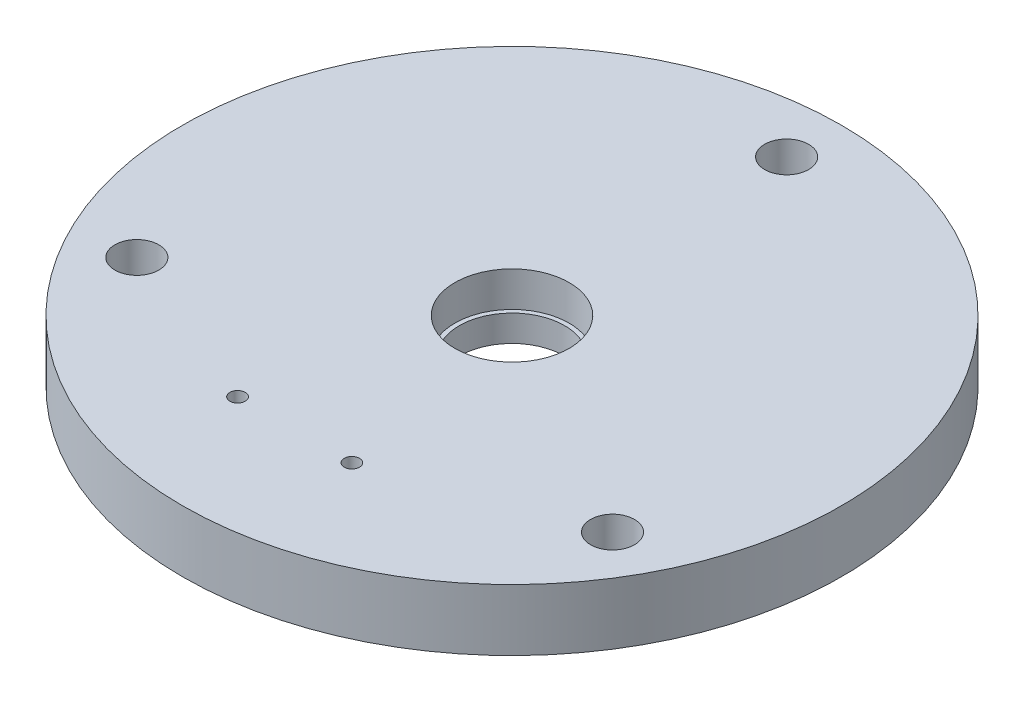
from build123d import *

# Parameters (mm, degrees)
SKETCH1_R           = 75
BOSS_EXTRUDE1_DEPTH = 14
SKETCH2_R           = 13
CUT_EXTRUDE1_DEPTH  = 8
SKETCH3_R           = 12
CUT_EXTRUDE2_DEPTH  = 8
SKETCH4_R           = 5
CUT_EXTRUDE4_DEPTH  = 107.98598039
SKETCH5_R           = 1.75
CUT_EXTRUDE5_DEPTH  = 107.98598039


with BuildPart() as part:
    # Sketch1 → Boss-Extrude1 (new body)
    with BuildSketch(Plane(origin=(0, 0, 0), x_dir=(1, 0, 0), z_dir=(0, 1, 0))):
        with Locations(Location((0, 0, 0), (0, 0, 270))):
            Circle(SKETCH1_R)
    extrude(amount=BOSS_EXTRUDE1_DEPTH)

    # Sketch2 → Cut-Extrude1 (cut)
    with BuildSketch(Plane(origin=(0, 14, 0), x_dir=(1, 0, 0), z_dir=(0, 1, 0))):
        with Locations(Location((0, 0, 0), (0, 0, 270))):
            Circle(SKETCH2_R)
    extrude(amount=-CUT_EXTRUDE1_DEPTH, mode=Mode.SUBTRACT)

    # Sketch3 → Cut-Extrude2 (cut)
    with BuildSketch(Plane(origin=(0, 6, 0), x_dir=(1, 0, 0), z_dir=(0, 1, 0))):
        with Locations(Location((0, 0, 0), (0, 0, 270))):
            Circle(SKETCH3_R)
    extrude(amount=-CUT_EXTRUDE2_DEPTH, mode=Mode.SUBTRACT)

    # Sketch4 → Cut-Extrude4 (cut, through all)
    with BuildSketch(Plane(origin=(0, 14, 0), x_dir=(1, 0, 0), z_dir=(0, 1, 0))):
        with Locations(Location((0, 62.5, 0), (0, 0, 270))):
            Circle(SKETCH4_R)
        with Locations(Location((-54.126587737, -31.25, 0), (0, 0, 270))):
            Circle(SKETCH4_R)
        with Locations(Location((54.126587737, -31.25, 0), (0, 0, 270))):
            Circle(SKETCH4_R)
    extrude(amount=-CUT_EXTRUDE4_DEPTH, mode=Mode.SUBTRACT)

    # Sketch5 → Cut-Extrude5 (cut, through all)
    with BuildSketch(Plane(origin=(0, 14, 0), x_dir=(1, 0, 0), z_dir=(0, 1, 0))):
        with Locations(Location((-15.201634245, -47.250661584, 0), (0, 0, 270))):
            Circle(SKETCH5_R)
        with Locations(Location((10.798365755, -47.250661584, 0), (0, 0, 270))):
            Circle(SKETCH5_R)
    extrude(amount=-CUT_EXTRUDE5_DEPTH, mode=Mode.SUBTRACT)


solid = part.part
